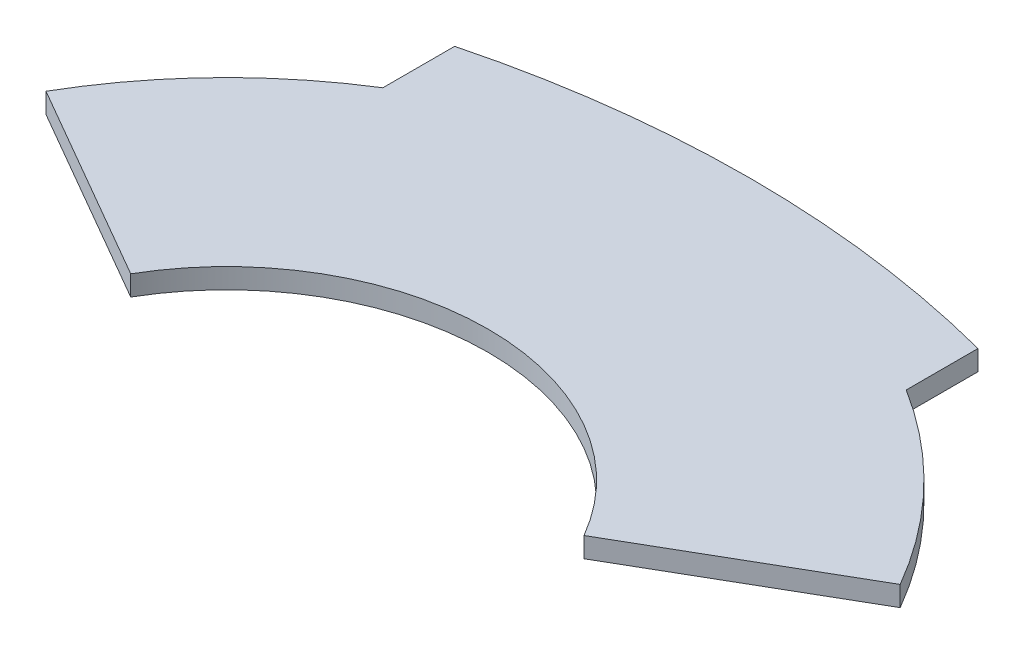
from build123d import *

# Parameters (mm, degrees)
EXTRUDE_1_DEPTH = 2


with BuildPart() as part:
    # 草图1 → 凸台-拉伸1 (new body)
    with BuildSketch(Plane(origin=(0, 0, 0), x_dir=(1, 0, 0), z_dir=(0, 1, 0))):
        with BuildLine():
            Line((-26, 99.664436987), (-26, 96.560861637))
            Line((-26, 96.560861637), (-26, 92.533119315))
            ThreePointArc((-26, 92.533119315), (-35.261557972, 85.02385236), (-42.435244785, 75.5))
            Line((-42.435244785, 75.5), (-22.516660498, 64))
            ThreePointArc((-22.516660498, 64), (0, 77), (22.516660498, 64))
            Line((22.516660498, 64), (42.435244785, 75.5))
            ThreePointArc((42.435244785, 75.5), (35.261557972, 85.02385236), (26, 92.533119315))
            Line((26, 92.533119315), (26, 96.560861637))
            Line((26, 96.560861637), (26, 99.664436987))
            ThreePointArc((26, 99.664436987), (0, 103), (-26, 99.664436987))
        make_face()
    extrude(amount=EXTRUDE_1_DEPTH)


solid = part.part
